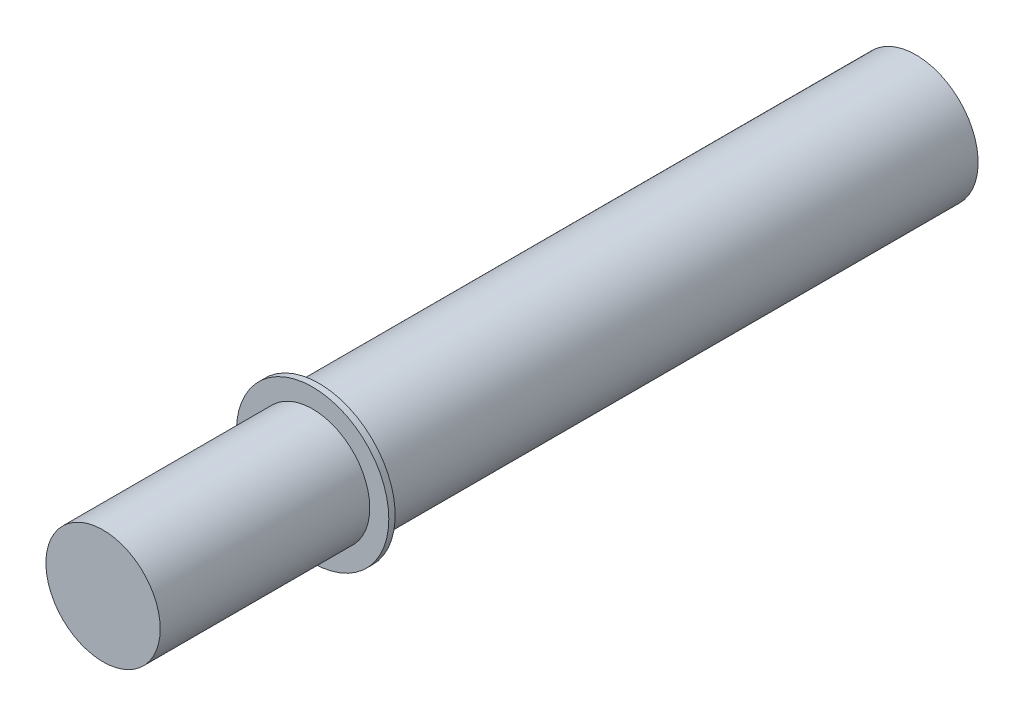
from build123d import *

# Parameters (mm, degrees)
SZKIC1_R                    = 6
DODANIE_WYCI_GNI_CIE1_DEPTH = 64
SZKIC2_OUTSIDE_W            = 27.242
SZKIC2_OUTSIDE_H            = 27.242
SZKIC2_OUTSIDE_R            = 4.9
WYTNIJ_WYCI_GNI_CIE1_DEPTH  = 47
SZKIC3_OUTSIDE_W            = 27.242
SZKIC3_OUTSIDE_H            = 27.242
SZKIC3_OUTSIDE_R            = 4.5
WYTNIJ_WYCI_GNI_CIE2_DEPTH  = 16.5


with BuildPart() as part:
    # Szkic1 → Dodanie-wyciągnięcie1 (new body)
    with BuildSketch(Plane.XY):
        Circle(SZKIC1_R)
    extrude(amount=DODANIE_WYCI_GNI_CIE1_DEPTH)

    # Szkic2 outside → Wytnij-wyciągnięcie1 (cut)
    with BuildSketch(Plane(origin=(0, 0, 0), x_dir=(-1, 0, 0), z_dir=(0, 0, -1))):
        Rectangle(SZKIC2_OUTSIDE_W, SZKIC2_OUTSIDE_H)
        Circle(SZKIC2_OUTSIDE_R, mode=Mode.SUBTRACT)
    extrude(amount=-WYTNIJ_WYCI_GNI_CIE1_DEPTH, mode=Mode.SUBTRACT)

    # Szkic3 outside → Wytnij-wyciągnięcie2 (cut)
    with BuildSketch(Plane.XY.offset(64)):
        Rectangle(SZKIC3_OUTSIDE_W, SZKIC3_OUTSIDE_H)
        Circle(SZKIC3_OUTSIDE_R, mode=Mode.SUBTRACT)
    extrude(amount=-WYTNIJ_WYCI_GNI_CIE2_DEPTH, mode=Mode.SUBTRACT)


solid = part.part
